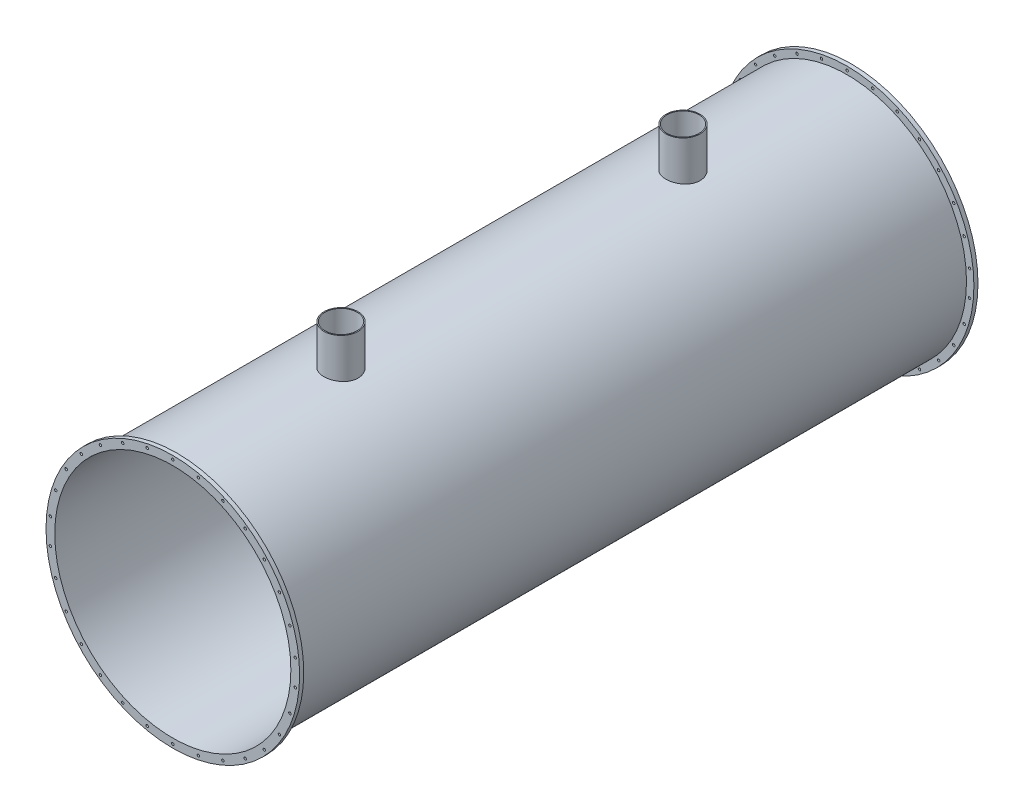
from build123d import *

# Parameters (mm, degrees)
SKETCH1_R                = 2130.0235
SKETCH1_R_2              = 2105.58
BOSS_EXTRUDE1_DEPTH      = 12100
BOSS_EXTRUDE2_REACH      = 13251.493
BOSS_EXTRUDE2_END_RADIUS = 2130.0235
SKETCH2_R                = 304.8
SKETCH3_R                = 287
CUT_EXTRUDE1_DEPTH       = 1000
BOSS_EXTRUDE3_START      = -73
SKETCH4_R                = 2262.0235
SKETCH4_R_2              = 2130.0235
BOSS_EXTRUDE3_DEPTH      = 73
SKETCH5_R                = 22
CUT_EXTRUDE3_DEPTH       = 73
SKETCH7_R                = 2262.0235
SKETCH7_R_2              = 2130.0235
BOSS_EXTRUDE4_DEPTH      = 73
CUT_EXTRUDE4_START       = -73
SKETCH8_R                = 22
CUT_EXTRUDE4_DEPTH       = 73


with BuildPart() as part:
    # Sketch1 → Boss-Extrude1 (new body)
    with BuildSketch(Plane.XY):
        Circle(SKETCH1_R)
        Circle(SKETCH1_R_2, mode=Mode.SUBTRACT)
    extrude(amount=BOSS_EXTRUDE1_DEPTH)

    # Boss-Extrude2: up to this cylinder (the profile starts outside it)
    boss_extrude2_end = Plane(origin=(0, 0, 6050), z_dir=(0, 0, -1)) * Cylinder(BOSS_EXTRUDE2_END_RADIUS, 36864.033, mode=Mode.PRIVATE)
    # Sketch2 → Boss-Extrude2 (add, up to the surface)
    with BuildSketch(Plane(origin=(0, 2830.0235, 0), x_dir=(1, 0, 0), z_dir=(0, 1, 0)), mode=Mode.PRIVATE) as boss_extrude2_sk1:
        with Locations(Location((0, -3000, 0), (0, 0, 270))):
            Circle(SKETCH2_R)
    boss_extrude2_tool1 = extrude(boss_extrude2_sk1.sketch, amount=-BOSS_EXTRUDE2_REACH, mode=Mode.PRIVATE) - boss_extrude2_end
    add(boss_extrude2_tool1.solids().sort_by_distance((0, 2830.0235, 3000))[0])
    # Sketch2 → Boss-Extrude2 (add, up to the surface)
    with BuildSketch(Plane(origin=(0, 2830.0235, 0), x_dir=(1, 0, 0), z_dir=(0, 1, 0)), mode=Mode.PRIVATE) as boss_extrude2_sk2:
        with Locations(Location((0, -9100, 0), (0, 0, 270))):
            Circle(SKETCH2_R)
    boss_extrude2_tool2 = extrude(boss_extrude2_sk2.sketch, amount=-BOSS_EXTRUDE2_REACH, mode=Mode.PRIVATE) - boss_extrude2_end
    add(boss_extrude2_tool2.solids().sort_by_distance((0, 2830.0235, 9100))[0])

    # Sketch3 → Cut-Extrude1 (cut)
    with BuildSketch(Plane(origin=(0, 2830.0235, 0), x_dir=(1, 0, 0), z_dir=(0, 1, 0))):
        with Locations(Location((0, -9100, 0), (0, 0, 270))):
            Circle(SKETCH3_R)
        with Locations(Location((0, -3000, 0), (0, 0, 270))):
            Circle(SKETCH3_R)
    extrude(amount=-CUT_EXTRUDE1_DEPTH, mode=Mode.SUBTRACT)

    # Sketch4 → Boss-Extrude3 (add)
    with BuildSketch(Plane.XY.offset(12100).offset(BOSS_EXTRUDE3_START)):
        Circle(SKETCH4_R)
        Circle(SKETCH4_R_2, mode=Mode.SUBTRACT)
    extrude(amount=BOSS_EXTRUDE3_DEPTH)

    # Sketch5 → Cut-Extrude3 (cut)
    with BuildSketch(Plane.XY.offset(12100)):
        with Locations((0, 2196.035)):
            Circle(SKETCH5_R)
        with Locations((456.581349945, 2148.046366377)):
            Circle(SKETCH5_R)
        with Locations((893.207903977, 2006.177799074)):
            Circle(SKETCH5_R)
        with Locations((1290.796986518, 1776.629635242)):
            Circle(SKETCH5_R)
        with Locations((1631.972046817, 1469.434231135)):
            Circle(SKETCH5_R)
        with Locations((1901.8220976, 1098.0175)):
            Circle(SKETCH5_R)
        with Locations((2088.553396762, 678.612135242)):
            Circle(SKETCH5_R)
        with Locations((2184.004890495, 229.548163832)):
            Circle(SKETCH5_R)
        with Locations((2184.004890495, -229.548163832)):
            Circle(SKETCH5_R)
        with Locations((2088.553396762, -678.612135242)):
            Circle(SKETCH5_R)
        with Locations((1901.8220976, -1098.0175)):
            Circle(SKETCH5_R)
        with Locations((1631.972046817, -1469.434231135)):
            Circle(SKETCH5_R)
        with Locations((1290.796986518, -1776.629635242)):
            Circle(SKETCH5_R)
        with Locations((893.207903977, -2006.177799074)):
            Circle(SKETCH5_R)
        with Locations((456.581349945, -2148.046366377)):
            Circle(SKETCH5_R)
        with Locations((0, -2196.035)):
            Circle(SKETCH5_R)
        with Locations((-456.581349945, -2148.046366377)):
            Circle(SKETCH5_R)
        with Locations((-893.207903977, -2006.177799074)):
            Circle(SKETCH5_R)
        with Locations((-1290.796986518, -1776.629635242)):
            Circle(SKETCH5_R)
        with Locations((-1631.972046817, -1469.434231135)):
            Circle(SKETCH5_R)
        with Locations((-1901.8220976, -1098.0175)):
            Circle(SKETCH5_R)
        with Locations((-2088.553396762, -678.612135242)):
            Circle(SKETCH5_R)
        with Locations((-2184.004890495, -229.548163832)):
            Circle(SKETCH5_R)
        with Locations((-2184.004890495, 229.548163832)):
            Circle(SKETCH5_R)
        with Locations((-2088.553396762, 678.612135242)):
            Circle(SKETCH5_R)
        with Locations((-1901.8220976, 1098.0175)):
            Circle(SKETCH5_R)
        with Locations((-1631.972046817, 1469.434231135)):
            Circle(SKETCH5_R)
        with Locations((-1290.796986518, 1776.629635242)):
            Circle(SKETCH5_R)
        with Locations((-893.207903977, 2006.177799074)):
            Circle(SKETCH5_R)
        with Locations((-456.581349945, 2148.046366377)):
            Circle(SKETCH5_R)
    extrude(amount=-CUT_EXTRUDE3_DEPTH, mode=Mode.SUBTRACT)

    # Sketch7 → Boss-Extrude4 (add)
    with BuildSketch(Plane(origin=(0, 0, 0), x_dir=(-1, 0, 0), z_dir=(0, 0, -1))):
        with Locations(Location((0, 0, 0), (0, 0, 180))):
            Circle(SKETCH7_R)
        Circle(SKETCH7_R_2, mode=Mode.SUBTRACT)
    extrude(amount=-BOSS_EXTRUDE4_DEPTH)

    # Sketch8 → Cut-Extrude4 (cut)
    with BuildSketch(Plane(origin=(0, 0, 0), x_dir=(-1, 0, 0), z_dir=(0, 0, -1)).offset(CUT_EXTRUDE4_START)):
        with Locations(Location((-1631.972046817, 1469.434231135, 0), (0, 0, 180))):
            Circle(SKETCH8_R)
        with Locations(Location((-1290.796986518, 1776.629635242, 0), (0, 0, 180))):
            Circle(SKETCH8_R)
        with Locations(Location((-893.207903977, 2006.177799074, 0), (0, 0, 180))):
            Circle(SKETCH8_R)
        with Locations(Location((-456.581349945, 2148.046366377, 0), (0, 0, 180))):
            Circle(SKETCH8_R)
        with Locations(Location((0, 2196.035, 0), (0, 0, 180))):
            Circle(SKETCH8_R)
        with Locations(Location((-1290.796986518, -1776.629635242, 0), (0, 0, 180))):
            Circle(SKETCH8_R)
        with Locations(Location((-1631.972046817, -1469.434231135, 0), (0, 0, 180))):
            Circle(SKETCH8_R)
        with Locations(Location((-1901.8220976, -1098.0175, 0), (0, 0, 180))):
            Circle(SKETCH8_R)
        with Locations(Location((-2088.553396762, -678.612135242, 0), (0, 0, 180))):
            Circle(SKETCH8_R)
        with Locations(Location((-2184.004890495, -229.548163832, 0), (0, 0, 180))):
            Circle(SKETCH8_R)
        with Locations(Location((-2184.004890495, 229.548163832, 0), (0, 0, 180))):
            Circle(SKETCH8_R)
        with Locations(Location((-2088.553396762, 678.612135242, 0), (0, 0, 180))):
            Circle(SKETCH8_R)
        with Locations(Location((-1901.8220976, 1098.0175, 0), (0, 0, 180))):
            Circle(SKETCH8_R)
        with Locations(Location((1901.8220976, -1098.0175, 0), (0, 0, 180))):
            Circle(SKETCH8_R)
        with Locations(Location((1631.972046817, -1469.434231135, 0), (0, 0, 180))):
            Circle(SKETCH8_R)
        with Locations(Location((1290.796986518, -1776.629635242, 0), (0, 0, 180))):
            Circle(SKETCH8_R)
        with Locations(Location((893.207903977, -2006.177799074, 0), (0, 0, 180))):
            Circle(SKETCH8_R)
        with Locations(Location((456.581349945, -2148.046366377, 0), (0, 0, 180))):
            Circle(SKETCH8_R)
        with Locations(Location((0, -2196.035, 0), (0, 0, 180))):
            Circle(SKETCH8_R)
        with Locations(Location((-456.581349945, -2148.046366377, 0), (0, 0, 180))):
            Circle(SKETCH8_R)
        with Locations(Location((-893.207903977, -2006.177799074, 0), (0, 0, 180))):
            Circle(SKETCH8_R)
        with Locations(Location((893.207903977, 2006.177799074, 0), (0, 0, 180))):
            Circle(SKETCH8_R)
        with Locations(Location((1290.796986518, 1776.629635242, 0), (0, 0, 180))):
            Circle(SKETCH8_R)
        with Locations(Location((1631.972046817, 1469.434231135, 0), (0, 0, 180))):
            Circle(SKETCH8_R)
        with Locations(Location((1901.8220976, 1098.0175, 0), (0, 0, 180))):
            Circle(SKETCH8_R)
        with Locations(Location((2088.553396762, 678.612135242, 0), (0, 0, 180))):
            Circle(SKETCH8_R)
        with Locations(Location((2184.004890495, 229.548163832, 0), (0, 0, 180))):
            Circle(SKETCH8_R)
        with Locations(Location((2184.004890495, -229.548163832, 0), (0, 0, 180))):
            Circle(SKETCH8_R)
        with Locations(Location((2088.553396762, -678.612135242, 0), (0, 0, 180))):
            Circle(SKETCH8_R)
        with Locations(Location((456.581349945, 2148.046366377, 0), (0, 0, 180))):
            Circle(SKETCH8_R)
    extrude(amount=CUT_EXTRUDE4_DEPTH, mode=Mode.SUBTRACT)


solid = part.part
